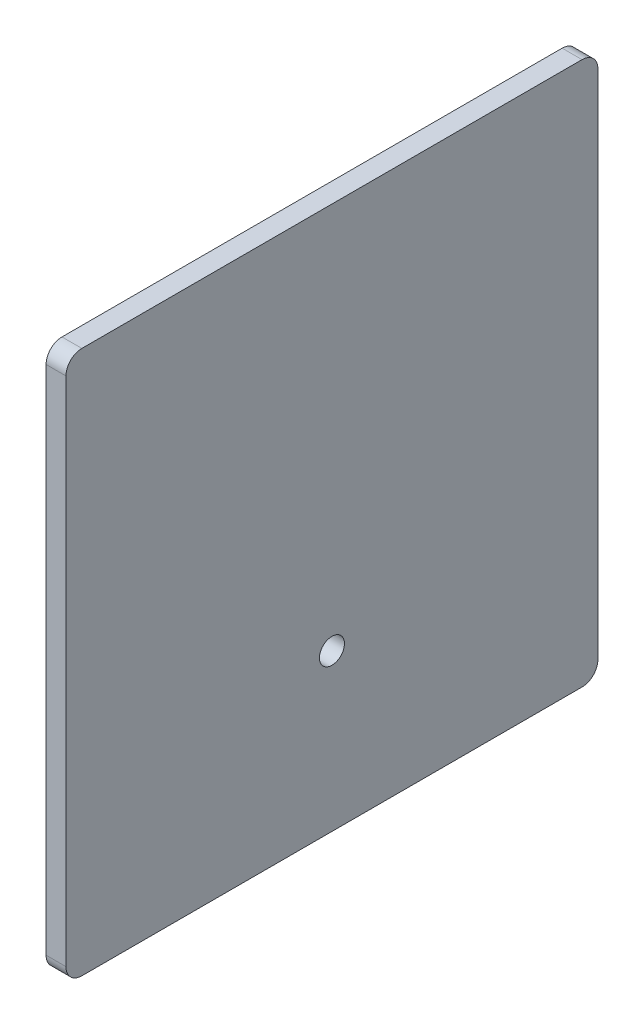
from build123d import *

# Parameters (mm, degrees)
SKETCH1_W           = 84.999999926
SKETCH1_H           = 86.825000086
BOSS_EXTRUDE1_DEPTH = 3.175
SKETCH2_R           = 2
CUT_EXTRUDE1_DEPTH  = 61.835645652
FILLET1_R           = 2.54


with BuildPart() as part:
    # Sketch1 → Boss-Extrude1 (new body)
    with BuildSketch(Plane(origin=(0, 0, 0), x_dir=(0, 0, -1), z_dir=(1, 0, 0))):
        Rectangle(SKETCH1_W, SKETCH1_H)
    extrude(amount=BOSS_EXTRUDE1_DEPTH)

    # Sketch2 → Cut-Extrude1 (cut, through all)
    with BuildSketch(Plane(origin=(3.175, 0, 0), x_dir=(0, 0, -1), z_dir=(1, 0, 0))):
        with Locations((3.7e-08, -18.412500043)):
            Circle(SKETCH2_R)
    extrude(amount=-CUT_EXTRUDE1_DEPTH, mode=Mode.SUBTRACT)

    # Fillet1
    fillet1_edges = [part.edges().sort_by_distance(p)[0] for p in [
        (1.5875, 43.412500043, 42.499999963),
        (1.5875, 43.412500043, -42.499999963),
        (1.5875, -43.412500043, -42.499999963),
        (1.5875, -43.412500043, 42.499999963),
    ]]
    fillet(fillet1_edges, radius=FILLET1_R)


solid = part.part
